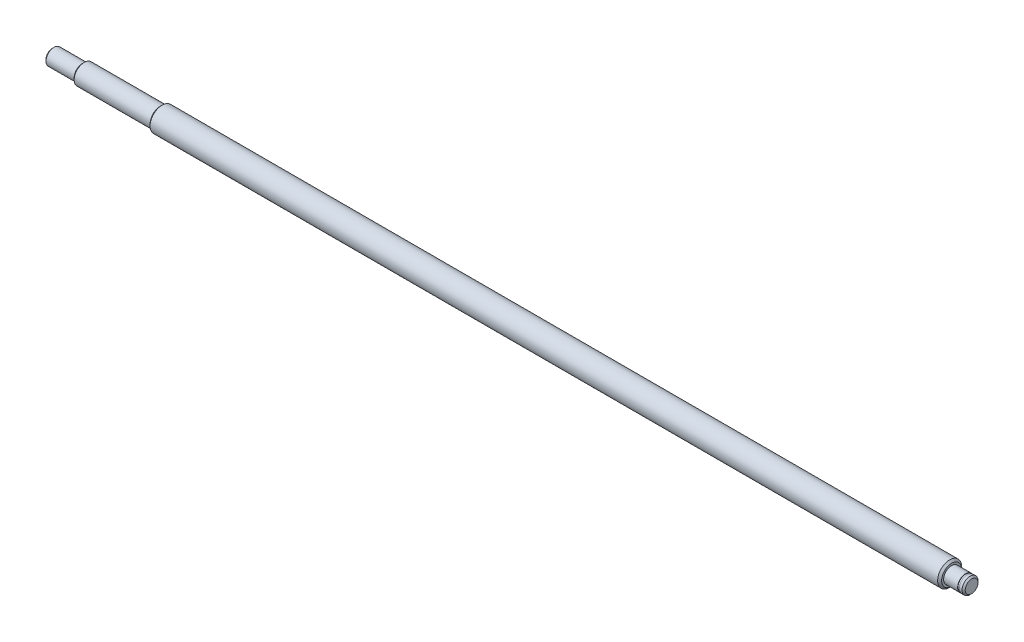
from build123d import *


with BuildPart() as part:
    # Esquisse1 → Révolution1 (revolve)
    with BuildSketch(Plane.XY, mode=Mode.PRIVATE) as r_volution1_sk:
        Polygon((-250, 0), (-250, 3.2), (-249.2, 4), (-235, 4), (-235, 4.1), (-234.1, 5), (-196, 5), (-196, 5.1), (-195.1, 6), (199, 6), (200, 5), (200, 4), (207, 4), (207, 3.8), (207.9, 3.8), (207.9, 4), (209.2, 4), (210, 3.2), (210, 0), align=None)
    revolve(r_volution1_sk.sketch.rotate(Axis((-511.970894611, 0, 0), (1, 0, 0)), 180), axis=Axis((-511.970894611, 0, 0), (1, 0, 0)))


solid = part.part
